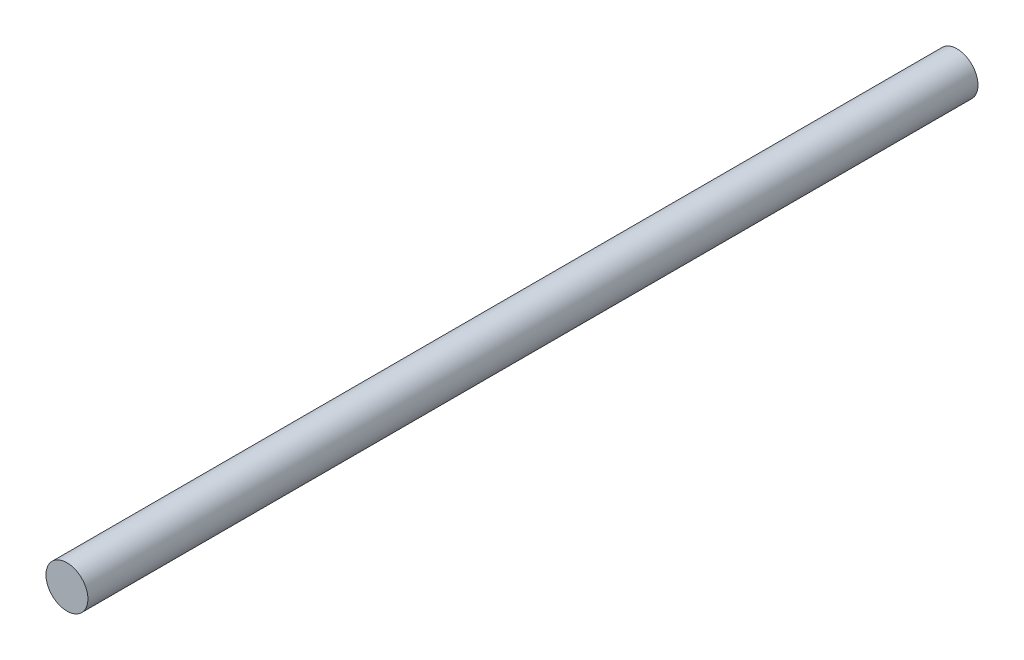
from build123d import *

# Parameters (mm, degrees)
SKETCH1_R           = 7.185
BOSS_EXTRUDE1_DEPTH = 305


with BuildPart() as part:
    # Sketch1 → Boss-Extrude1 (new body)
    with BuildSketch(Plane.XY):
        Circle(SKETCH1_R)
    extrude(amount=BOSS_EXTRUDE1_DEPTH)


solid = part.part
